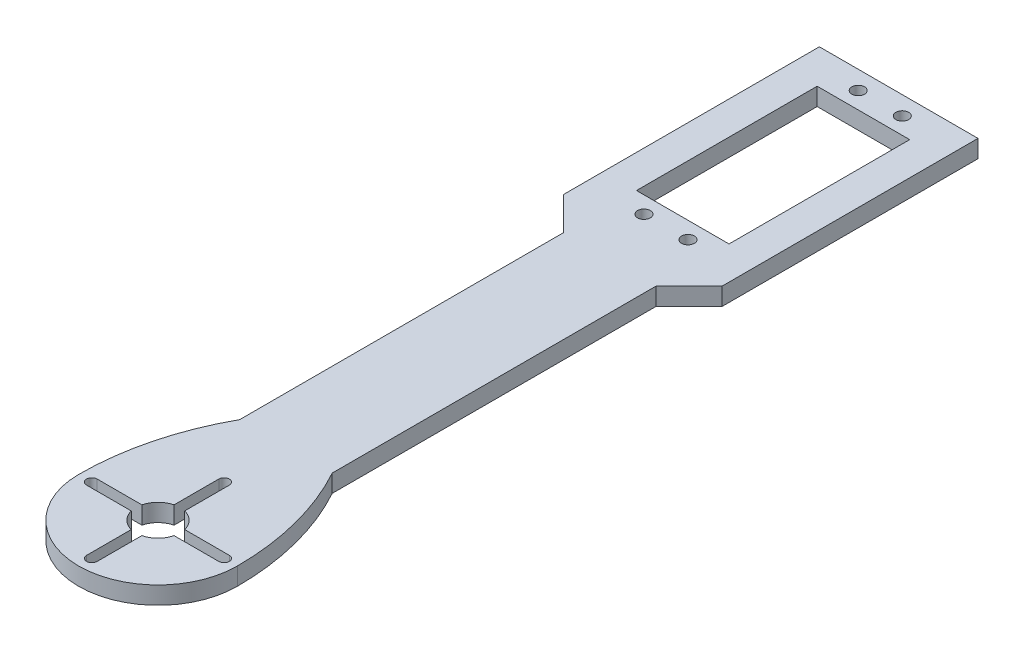
from build123d import *

# Parameters (mm, degrees)
SKETCH_1_R          = 1.45
SKETCH_1_W          = 21
SKETCH_1_H          = 41
EXTRUDE_1_DEPTH     = 4
CUT_EXTRUDE_1_DEPTH = 170.103308735
EXTRUDE_2_DEPTH     = 2


with BuildPart() as part:
    # 스케치1 → 보스-돌출1 (new body)
    with BuildSketch(Plane(origin=(0, 0, 0), x_dir=(1, 0, 0), z_dir=(0, 1, 0))):
        with BuildLine():
            Line((18, 0), (18, 168.095))
            Line((18, 168.095), (-18, 168.095))
            Line((-18, 168.095), (-18, 0))
            ThreePointArc((-18, 0), (0, -18), (18, 0))
        make_face()
        with BuildLine():
            ThreePointArc((-15, -1.2), (-16.2, 0), (-15, 1.2))
            Line((-15, 1.2), (-4.85386444, 1.2))
            ThreePointArc((-4.85386444, 1.2), (-3.535533906, 3.535533906), (-1.2, 4.85386444))
            Line((-1.2, 4.85386444), (-1.2, 15))
            ThreePointArc((-1.2, 15), (0, 16.2), (1.2, 15))
            Line((1.2, 15), (1.2, 4.85386444))
            ThreePointArc((1.2, 4.85386444), (3.535533906, 3.535533906), (4.85386444, 1.2))
            Line((4.85386444, 1.2), (15, 1.2))
            ThreePointArc((15, 1.2), (16.2, 0), (15, -1.2))
            Line((15, -1.2), (4.85386444, -1.2))
            ThreePointArc((4.85386444, -1.2), (3.535533906, -3.535533906), (1.2, -4.85386444))
            Line((1.2, -4.85386444), (1.2, -15))
            ThreePointArc((1.2, -15), (0, -16.2), (-1.2, -15))
            Line((-1.2, -15), (-1.2, -4.85386444))
            ThreePointArc((-1.2, -4.85386444), (-3.535533906, -3.535533906), (-4.85386444, -1.2))
            Line((-4.85386444, -1.2), (-15, -1.2))
        make_face(mode=Mode.SUBTRACT)
        with Locations(Location((-5, 115.28, 0), (0, 0, 270))):
            Circle(SKETCH_1_R, mode=Mode.SUBTRACT)
        with Locations(Location((-5, 163.91, 0), (0, 0, 270))):
            Circle(SKETCH_1_R, mode=Mode.SUBTRACT)
        with Locations(Location((5, 115.28, 0), (0, 0, 270))):
            Circle(SKETCH_1_R, mode=Mode.SUBTRACT)
        with Locations((0, 139.595)):
            Rectangle(SKETCH_1_W, SKETCH_1_H, mode=Mode.SUBTRACT)
        with Locations(Location((5, 163.91, 0), (0, 0, 270))):
            Circle(SKETCH_1_R, mode=Mode.SUBTRACT)
    extrude(amount=EXTRUDE_1_DEPTH)

    # 스케치2 → 컷-돌출1 (cut, through all)
    with BuildSketch(Plane(origin=(0, 4, 0), x_dir=(1, 0, 0), z_dir=(0, 1, 0))):
        with BuildLine():
            Line((-18, 110), (-10.5, 102.5))
            Line((-10.5, 102.5), (-10.5, 29.047375097))
            ThreePointArc((-10.5, 29.047375097), (-16.094750193, 15), (-18, 0))
            Line((-18, 0), (-18, 110))
        make_face()
    cut_extrude_1 = extrude(amount=-CUT_EXTRUDE_1_DEPTH, mode=Mode.SUBTRACT)

    # 대칭 복사1: 컷-돌출1 across plane
    add(cut_extrude_1.mirror(Plane(origin=(0, 0, 0), x_dir=(0, 0, 1), z_dir=(1, 0, 0))), mode=Mode.SUBTRACT)

    # 스케치3 → 보스-돌출2 (add, symmetric)
    with BuildSketch(Plane(origin=(0, 0, 0), x_dir=(0, 0, -1), z_dir=(1, 0, 0))):
        with BuildLine():
            Line((25, 0), (105, 0))
            ThreePointArc((105, 0), (65, -5.431677052), (25, 0))
        make_face()
    extrude(amount=EXTRUDE_2_DEPTH, both=True)


solid = part.part
